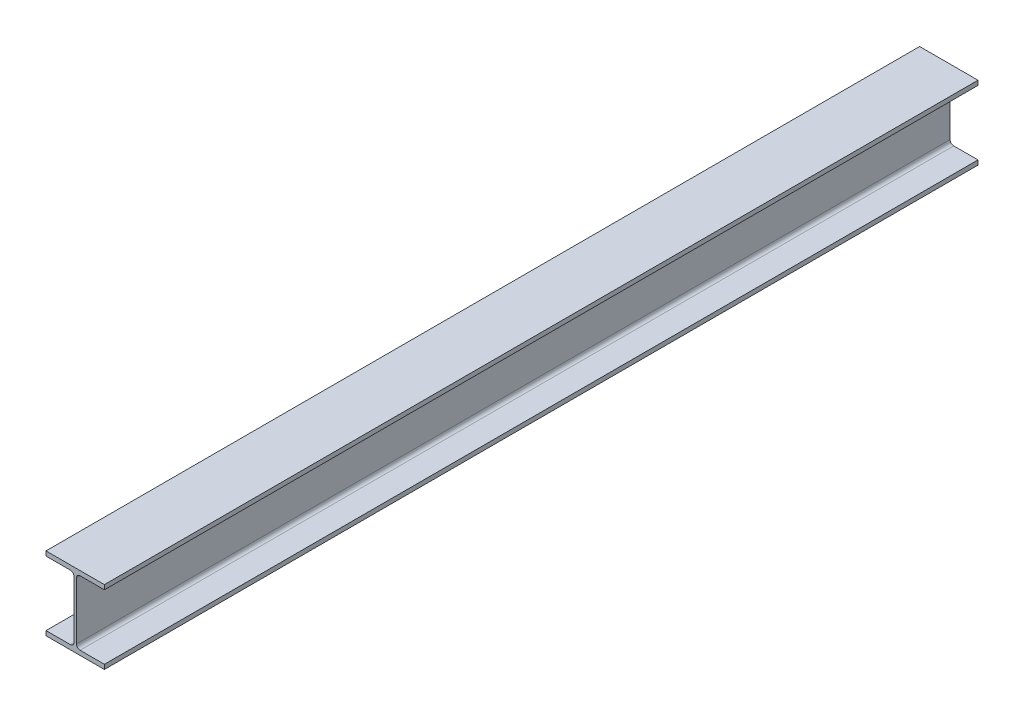
from build123d import *

# Parameters (mm, degrees)
BASESTEELW_DEPTH = 1524


with BuildPart() as part:
    # Sketch1 → BaseSteelW (new, symmetric)
    with BuildSketch(Plane.XY):
        with BuildLine():
            Line((0, 0), (0, 15.748))
            Line((0, 15.748), (84.709, 15.748))
            ThreePointArc((84.709, 15.748), (93.689256121, 19.467743879), (97.409, 28.448))
            Line((97.409, 28.448), (97.409, 228.092))
            ThreePointArc((97.409, 228.092), (93.689256121, 237.072256121), (84.709, 240.792))
            Line((84.709, 240.792), (0, 240.792))
            Line((0, 240.792), (0, 256.54))
            Line((0, 256.54), (203.708, 256.54))
            Line((203.708, 256.54), (203.708, 240.792))
            Line((203.708, 240.792), (118.999, 240.792))
            ThreePointArc((118.999, 240.792), (110.018743879, 237.072256121), (106.299, 228.092))
            Line((106.299, 228.092), (106.299, 28.448))
            ThreePointArc((106.299, 28.448), (110.018743879, 19.467743879), (118.999, 15.748))
            Line((118.999, 15.748), (203.708, 15.748))
            Line((203.708, 15.748), (203.708, 0))
            Line((203.708, 0), (0, 0))
        make_face()
    extrude(amount=BASESTEELW_DEPTH, both=True)


solid = part.part
